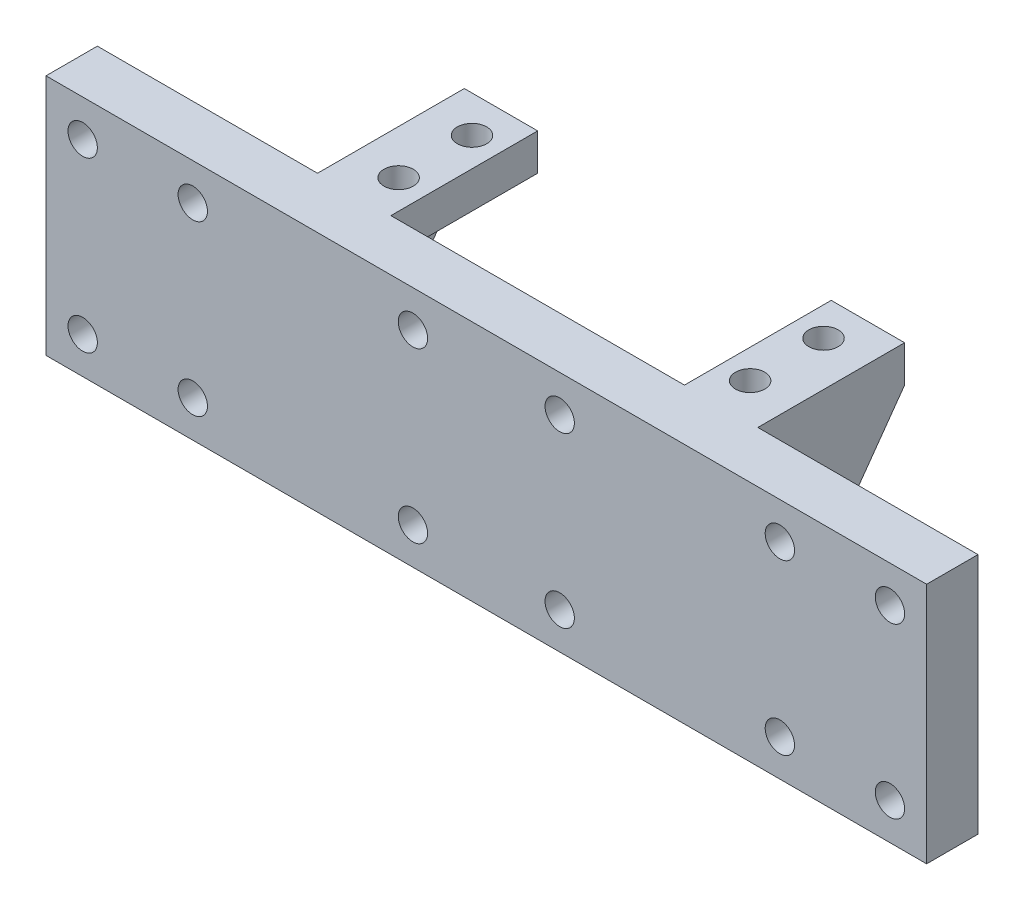
from build123d import *

# Parameters (mm, degrees)
SKETCH2_W               = 8
SKETCH2_H               = 20
SKETCH2_W_2             = 11.75
SKETCH2_H_2             = 12.66
BOSS_EXTRUDE1_DEPTH     = 5
SKETCH3_W               = 13.1
SKETCH3_H               = 7
BOSS_EXTRUDE2_DEPTH     = 28
SKETCH4_W               = 5.75
SKETCH4_H               = 12.66
CUT_EXTRUDE1_DEPTH      = 62.587336361
SKETCH5_R               = 2
CUT_EXTRUDE2_DEPTH      = 61.902073035
SKETCH6_R               = 2
CUT_EXTRUDE3_DEPTH      = 60.059292241
SKETCH7_W               = 7
SKETCH7_H               = 28
BOSS_EXTRUDE3_DEPTH     = 19.4
SKETCH8_W               = 27
SKETCH8_H               = 33
BOSS_EXTRUDE4_DEPTH     = 2
SKETCH9_W               = 27
SKETCH9_H               = 33
BOSS_EXTRUDE5_DEPTH     = 2
CUT_EXTRUDE4_DEPTH      = 68.4388612
CUT_EXTRUDE4_DEPTH_BACK = 68.4388612
SKETCH12_W              = 12.66
SKETCH12_H              = 33
CUT_EXTRUDE5_DEPTH      = 63.562468781
SKETCH13_W              = 30
SKETCH13_H              = 7
BOSS_EXTRUDE6_DEPTH     = 33
SKETCH14_R              = 2
CUT_EXTRUDE6_DEPTH      = 88.086164228


with BuildPart() as part:
    # Sketch2 → Boss-Extrude1 (new body)
    with BuildSketch(Plane(origin=(0, 0, 0), x_dir=(1, 0, 0), z_dir=(0, 1, 0))):
        with Locations((-4, 10)):
            Rectangle(SKETCH2_W, SKETCH2_H)
        Polygon((40, 0), (0, 0), (-8, 0), (-8, -7), (3.75, -7), (16.85, -7), (28.6, -7), (48, -7), (48, 0), align=None)
        with Locations((-2.125, -13.33)):
            Rectangle(SKETCH2_W_2, SKETCH2_H_2)
        with Locations((22.725, -13.33)):
            Rectangle(SKETCH2_W_2, SKETCH2_H_2)
        with Locations((44, 10)):
            Rectangle(SKETCH2_W, SKETCH2_H)
    extrude(amount=BOSS_EXTRUDE1_DEPTH)

    # Sketch3 → Boss-Extrude2 (add)
    with BuildSketch(Plane.XZ):
        Polygon((3.75, 19.66), (-8, 19.66), (-8, 0), (0, 0), (3.75, 0), (3.75, 7), align=None)
        with Locations((10.3, 3.5)):
            Rectangle(SKETCH3_W, SKETCH3_H)
        Polygon((16.85, 19.66), (16.85, 7), (16.85, 0), (28.6, 0), (28.6, 7), (28.6, 19.66), align=None)
    extrude(amount=BOSS_EXTRUDE2_DEPTH)

    # Sketch4 → Cut-Extrude1 (cut, through all)
    with BuildSketch(Plane.XZ.offset(28)):
        with Locations((-5.125, 13.33)):
            Rectangle(SKETCH4_W, SKETCH4_H)
        with Locations((25.725, 13.33)):
            Rectangle(SKETCH4_W, SKETCH4_H)
    extrude(amount=-CUT_EXTRUDE1_DEPTH, mode=Mode.SUBTRACT)

    # Sketch5 → Cut-Extrude2 (cut, through all)
    with BuildSketch(Plane.ZY.offset(2.25)):
        with Locations((13.33, -2)):
            Circle(SKETCH5_R)
        with Locations((13.33, -21)):
            Circle(SKETCH5_R)
        with Locations((13.33, -11.5)):
            Circle(SKETCH5_R)
    extrude(amount=-CUT_EXTRUDE2_DEPTH, mode=Mode.SUBTRACT)

    # Sketch6 → Cut-Extrude3 (cut, through all)
    with BuildSketch(Plane.XZ):
        with Locations(Location((43.95, -5, 0), (0, 0, 270))):
            Circle(SKETCH6_R)
        with Locations(Location((43.95, -15, 0), (0, 0, 270))):
            Circle(SKETCH6_R)
        with Locations(Location((-3.95, -5, 0), (0, 0, 270))):
            Circle(SKETCH6_R)
        with Locations(Location((-3.95, -15, 0), (0, 0, 270))):
            Circle(SKETCH6_R)
    extrude(amount=-CUT_EXTRUDE3_DEPTH, mode=Mode.SUBTRACT)

    # Sketch7 → Boss-Extrude3 (add)
    with BuildSketch(Plane(origin=(28.6, 0, 0), x_dir=(0, 0, -1), z_dir=(1, 0, 0))):
        with Locations((-3.5, -14)):
            Rectangle(SKETCH7_W, SKETCH7_H)
    extrude(amount=BOSS_EXTRUDE3_DEPTH)

    # Sketch8 → Boss-Extrude4 (add)
    with BuildSketch(Plane(origin=(48, 0, 0), x_dir=(0, 0, -1), z_dir=(1, 0, 0))):
        with Locations((6.5, -11.5)):
            Rectangle(SKETCH8_W, SKETCH8_H)
    extrude(amount=BOSS_EXTRUDE4_DEPTH)

    # Sketch9 → Boss-Extrude5 (add)
    with BuildSketch(Plane.ZY.offset(8)):
        with Locations((-6.5, -11.5)):
            Rectangle(SKETCH9_W, SKETCH9_H)
    extrude(amount=BOSS_EXTRUDE5_DEPTH)

    # Sketch10 → Cut-Extrude4 (cut, two sides: drawn at the far end of the back side and taken through both)
    with BuildSketch(Plane.ZY.offset(-48).offset(-CUT_EXTRUDE4_DEPTH_BACK)):
        Polygon((-20, 0), (0, -28), (-20, -28), align=None)
    extrude(amount=CUT_EXTRUDE4_DEPTH + CUT_EXTRUDE4_DEPTH_BACK, mode=Mode.SUBTRACT)

    # Sketch12 → Cut-Extrude5 (cut, through all)
    with BuildSketch(Plane.ZY.offset(2.25)):
        with Locations((13.33, -11.5)):
            Rectangle(SKETCH12_W, SKETCH12_H)
    extrude(amount=-CUT_EXTRUDE5_DEPTH, mode=Mode.SUBTRACT)

    # Sketch13 → Boss-Extrude6 (add)
    with BuildSketch(Plane(origin=(0, 5, 0), x_dir=(1, 0, 0), z_dir=(0, 1, 0))):
        with Locations((-25, -3.5)):
            Rectangle(SKETCH13_W, SKETCH13_H)
        with Locations((65, -3.5)):
            Rectangle(SKETCH13_W, SKETCH13_H)
    extrude(amount=-BOSS_EXTRUDE6_DEPTH)

    # Sketch14 → Cut-Extrude6 (cut, through all)
    with BuildSketch(Plane(origin=(0, 0, 0), x_dir=(-1, 0, 0), z_dir=(0, 0, -1))):
        with Locations((35, -23)):
            Circle(SKETCH14_R)
        with Locations((20, -23)):
            Circle(SKETCH14_R)
        with Locations((20, 0)):
            Circle(SKETCH14_R)
        with Locations((35, 0)):
            Circle(SKETCH14_R)
        with Locations((-10, 0)):
            Circle(SKETCH14_R)
        with Locations((-10, -23)):
            Circle(SKETCH14_R)
        with Locations((-30, -23)):
            Circle(SKETCH14_R)
        with Locations((-30, 0)):
            Circle(SKETCH14_R)
        with Locations((-60, 0)):
            Circle(SKETCH14_R)
        with Locations((-60, -23)):
            Circle(SKETCH14_R)
        with Locations((-75, -23)):
            Circle(SKETCH14_R)
        with Locations((-75, 0)):
            Circle(SKETCH14_R)
    extrude(amount=-CUT_EXTRUDE6_DEPTH, mode=Mode.SUBTRACT)


solid = part.part
